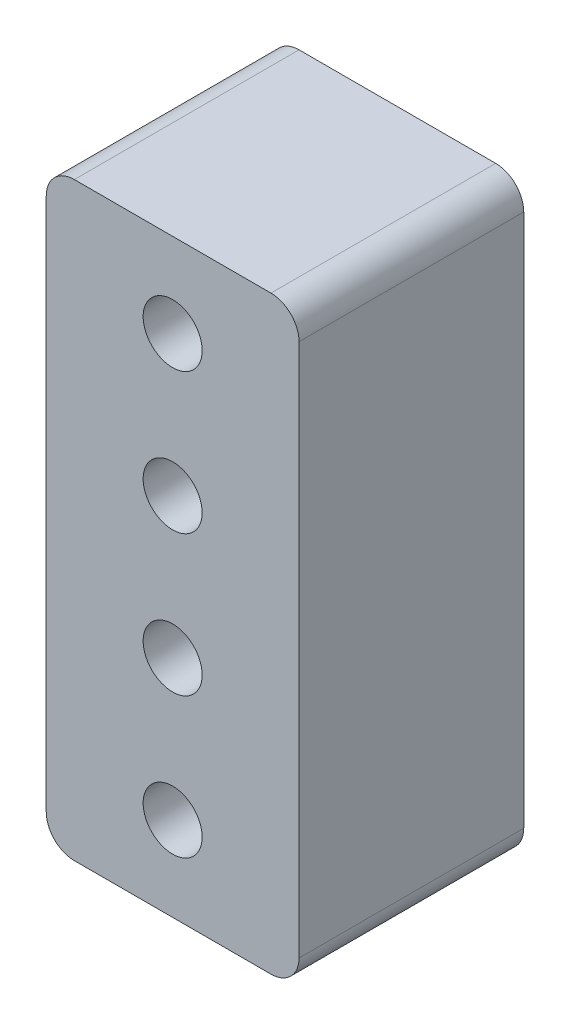
from build123d import *

# Parameters (mm, degrees)
SKETCH1_W           = 45
SKETCH1_H           = 105
BOSS_EXTRUDE1_DEPTH = 40
SKETCH2_R           = 5.25
CUT_EXTRUDE1_DEPTH  = 17.5
SKETCH7_R           = 2.5
SKETCH6_R           = 5.25
LPATTERN1_COUNT     = 4
LPATTERN1_PITCH     = 25
FILLET1_R           = 5


with BuildPart() as part:
    # Sketch1 → Boss-Extrude1 (new body)
    with BuildSketch(Plane.XY):
        with Locations((22.5, 52.5)):
            Rectangle(SKETCH1_W, SKETCH1_H)
    extrude(amount=BOSS_EXTRUDE1_DEPTH)

    # Sketch2 → Cut-Extrude1 (cut)
    with BuildSketch(Plane.XY.offset(40)):
        with Locations((22.5, 90)):
            Circle(SKETCH2_R)
    cut_extrude1 = extrude(amount=-CUT_EXTRUDE1_DEPTH, mode=Mode.SUBTRACT)

    # Sketch7 → Cut-Loft1 section 0
    with BuildSketch(Plane.XY.offset(7.5)):
        with Locations((22.5, 90)):
            Circle(SKETCH7_R)
    # Sketch6 → Cut-Loft1 section 1
    with BuildSketch(Plane.XY.offset(22.5)):
        with Locations((22.5, 90)):
            Circle(SKETCH6_R)
    cut_loft1 = loft(mode=Mode.SUBTRACT)

    # Sketch8 → Cut-Revolve1 (revolve, cut)
    with BuildSketch(Plane.XY.offset(7.5)):
        with BuildLine():
            Line((22.5, 92.5), (22.5, 87.5))
            ThreePointArc((22.5, 87.5), (20, 90), (22.5, 92.5))
        make_face()
    cut_revolve1 = revolve(axis=Axis((22.5, 105, 7.5), (0, 1, 0)), mode=Mode.SUBTRACT)

    # LPattern1: Cut-Extrude1, Cut-Loft1, Cut-Revolve1 ×4
    with Locations(*[(0, -i * LPATTERN1_PITCH, 0) for i in range(1, LPATTERN1_COUNT)]):
        add(cut_extrude1, mode=Mode.SUBTRACT)
        add(cut_loft1, mode=Mode.SUBTRACT)
        add(cut_revolve1, mode=Mode.SUBTRACT)

    # Fillet1
    fillet1_edges = [part.edges().sort_by_distance(p)[0] for p in [
        (0, 105, 20),
        (45, 105, 20),
        (45, 0, 20),
        (0, 0, 20),
    ]]
    fillet(fillet1_edges, radius=FILLET1_R)


solid = part.part
